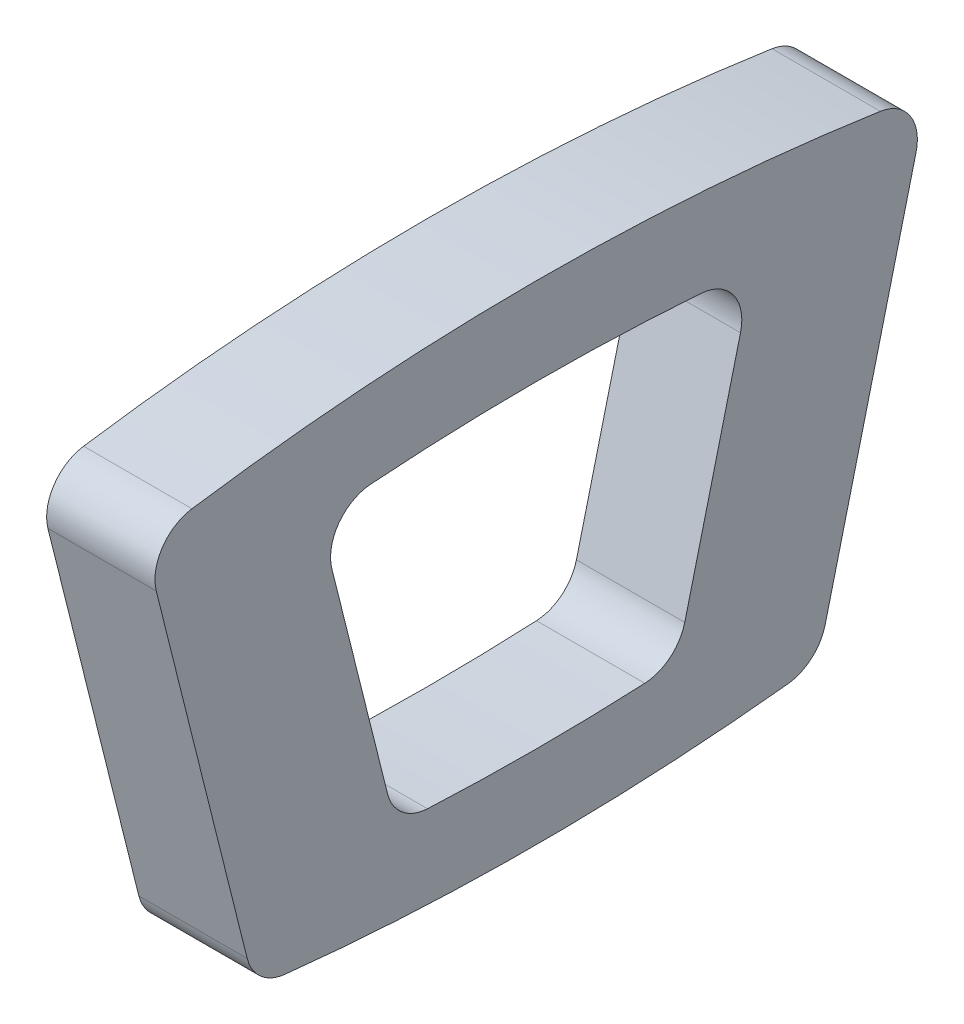
from build123d import *

# Parameters (mm, degrees)
EXTRUDE_1_DEPTH = 10


with BuildPart() as part:
    # Эскиз1 → Вытянуть1 (new body)
    with BuildSketch(Plane(origin=(0, 0, 0), x_dir=(0, 0, -1), z_dir=(1, 0, 0))):
        with BuildLine():
            Line((26.672393858, 176.18957543), (35.064656469, 209.758625876))
            ThreePointArc((35.064656469, 209.758625876), (34.509070686, 212.952387038), (31.769638193, 214.68567742))
            ThreePointArc((31.769638193, 214.68567742), (0, 217.023616226), (-31.769638193, 214.68567742))
            ThreePointArc((-31.769638193, 214.68567742), (-34.509070686, 212.952387038), (-35.064656469, 209.758625876))
            Line((-35.064656469, 209.758625876), (-26.672393858, 176.18957543))
            ThreePointArc((-26.672393858, 176.18957543), (-25.418843537, 174.143301579), (-23.219791878, 173.182678407))
            ThreePointArc((-23.219791878, 173.182678407), (0, 171.936937008), (23.219791878, 173.182678407))
            ThreePointArc((23.219791878, 173.182678407), (25.418843537, 174.143301579), (26.672393858, 176.18957543))
        make_face()
        with BuildLine():
            Line((13.715292518, 182.861170071), (18.86026165, 203.441046598))
            ThreePointArc((18.86026165, 203.441046598), (18.220421187, 206.755900608), (15.272036319, 208.400491618))
            ThreePointArc((15.272036319, 208.400491618), (0, 208.959326186), (-15.272036319, 208.400491618))
            ThreePointArc((-15.272036319, 208.400491618), (-18.220421187, 206.755900608), (-18.86026165, 203.441046598))
            Line((-18.86026165, 203.441046598), (-13.715292518, 182.861170071))
            ThreePointArc((-13.715292518, 182.861170071), (-12.371326308, 180.738475491), (-10.026657624, 179.835920111))
            ThreePointArc((-10.026657624, 179.835920111), (0, 179.595223033), (10.026657624, 179.835920111))
            ThreePointArc((10.026657624, 179.835920111), (12.371326308, 180.738475491), (13.715292518, 182.861170071))
        make_face(mode=Mode.SUBTRACT)
    extrude(amount=EXTRUDE_1_DEPTH)


solid = part.part
